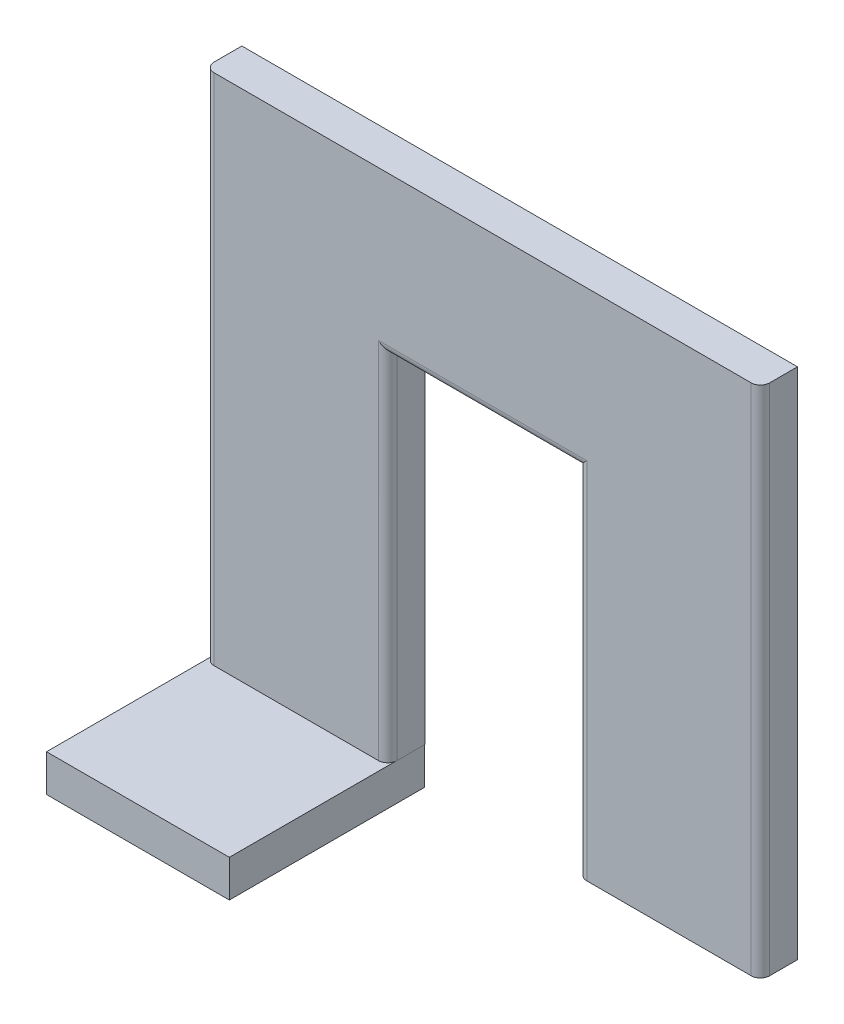
from build123d import *

# Parameters (mm, degrees)
SKETCH1_W           = 30
SKETCH1_H           = 27.727272728
BOSS_EXTRUDE1_DEPTH = 2
SKETCH2_W           = 10.248894408
SKETCH2_H           = 19.156033471
CUT_EXTRUDE1_DEPTH  = 2
FILLET1_R           = 0.5
FILLET2_R           = 0.5
FILLET3_R           = 0.5
FILLET4_R           = 0.5
FILLET5_R           = 0.5
SKETCH3_W           = 9.871005128
SKETCH3_H           = 10.546548519
BOSS_EXTRUDE2_DEPTH = 2


with BuildPart() as part:
    # Sketch1 → Boss-Extrude1 (new body)
    with BuildSketch(Plane.XY):
        Rectangle(SKETCH1_W, SKETCH1_H)
    extrude(amount=BOSS_EXTRUDE1_DEPTH)

    # Sketch2 → Cut-Extrude1 (cut)
    with BuildSketch(Plane.XY.offset(2)):
        with Locations((0, -4.294276099)):
            Rectangle(SKETCH2_W, SKETCH2_H)
    extrude(amount=-CUT_EXTRUDE1_DEPTH, mode=Mode.SUBTRACT)

    # Fillet1
    fillet1_edges = [part.edges().sort_by_distance(p)[0] for p in [
        (-15, 0, 2),
    ]]
    fillet(fillet1_edges, radius=FILLET1_R)

    # Fillet2
    fillet2_edges = [part.edges().sort_by_distance(p)[0] for p in [
        (15, 0, 2),
    ]]
    fillet(fillet2_edges, radius=FILLET2_R)

    # Fillet3
    fillet3_edges = [part.edges().sort_by_distance(p)[0] for p in [
        (-5.124447204, -4.289947863, 2),
    ]]
    fillet(fillet3_edges, radius=FILLET3_R)

    # Fillet4
    fillet4_edges = [part.edges().sort_by_distance(p)[0] for p in [
        (5.124447204, -4.289947863, 2),
    ]]
    fillet(fillet4_edges, radius=FILLET4_R)

    # Fillet5
    fillet5_edges = [part.edges().sort_by_distance(p)[0] for p in [
        (0, 5.283740637, 2),
    ]]
    fillet(fillet5_edges, radius=FILLET5_R)

    # Sketch3 → Boss-Extrude2 (add)
    with BuildSketch(Plane(origin=(0, -13.863636364, 0), x_dir=(-1, 0, 0), z_dir=(0, -1, 0))):
        with Locations((10.064497436, -5.273274259)):
            Rectangle(SKETCH3_W, SKETCH3_H)
    extrude(amount=BOSS_EXTRUDE2_DEPTH)


solid = part.part
